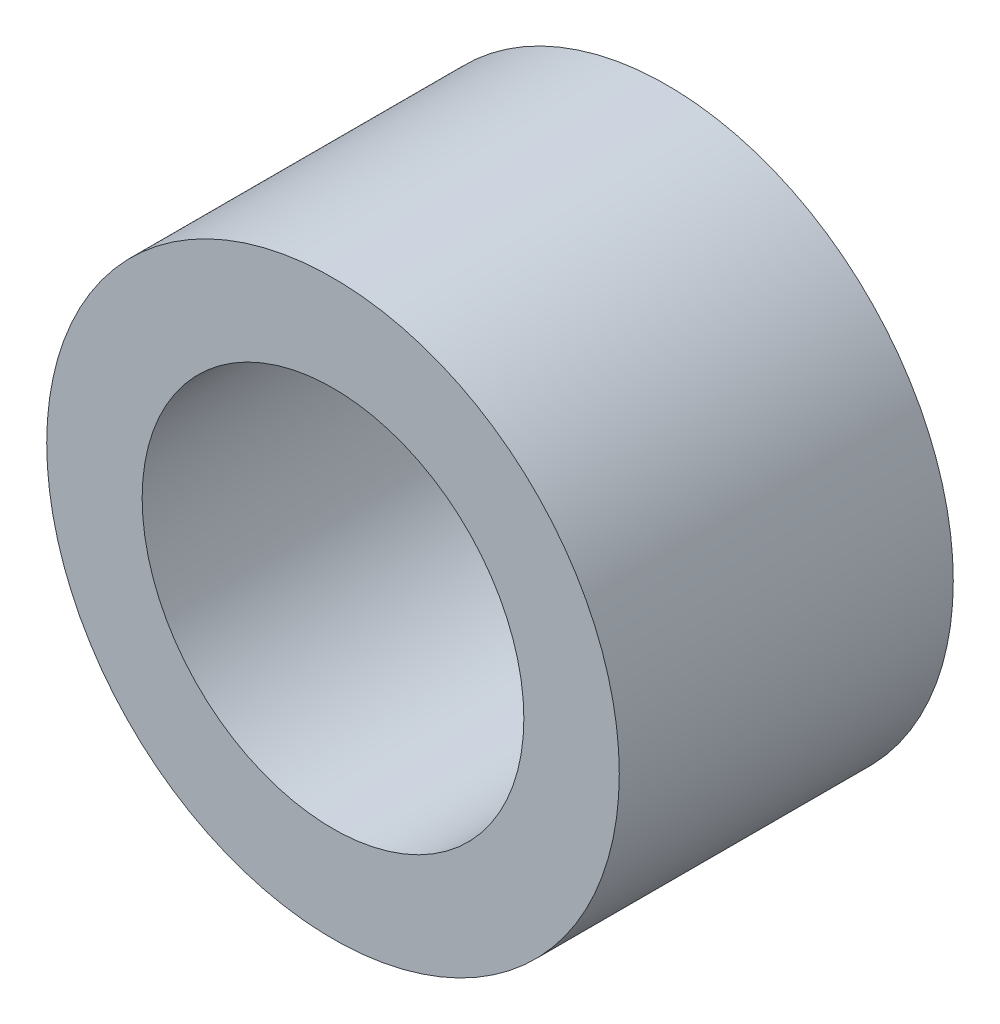
from build123d import *

# Parameters (mm, degrees)
SKETCH1_R           = 15
SKETCH1_R_2         = 10
BOSS_EXTRUDE1_DEPTH = 17.5
SCALE1_SCALE        = 0.5


with BuildPart() as part:
    # Sketch1 → Boss-Extrude1 (new body)
    with BuildSketch(Plane.XY):
        Circle(SKETCH1_R)
        Circle(SKETCH1_R_2, mode=Mode.SUBTRACT)
    extrude(amount=-BOSS_EXTRUDE1_DEPTH)


with BuildPart() as part_1:
    # Scale1: scaled about (0, 0, 0)
    add(part.part.scale(SCALE1_SCALE))


solid = part_1.part
